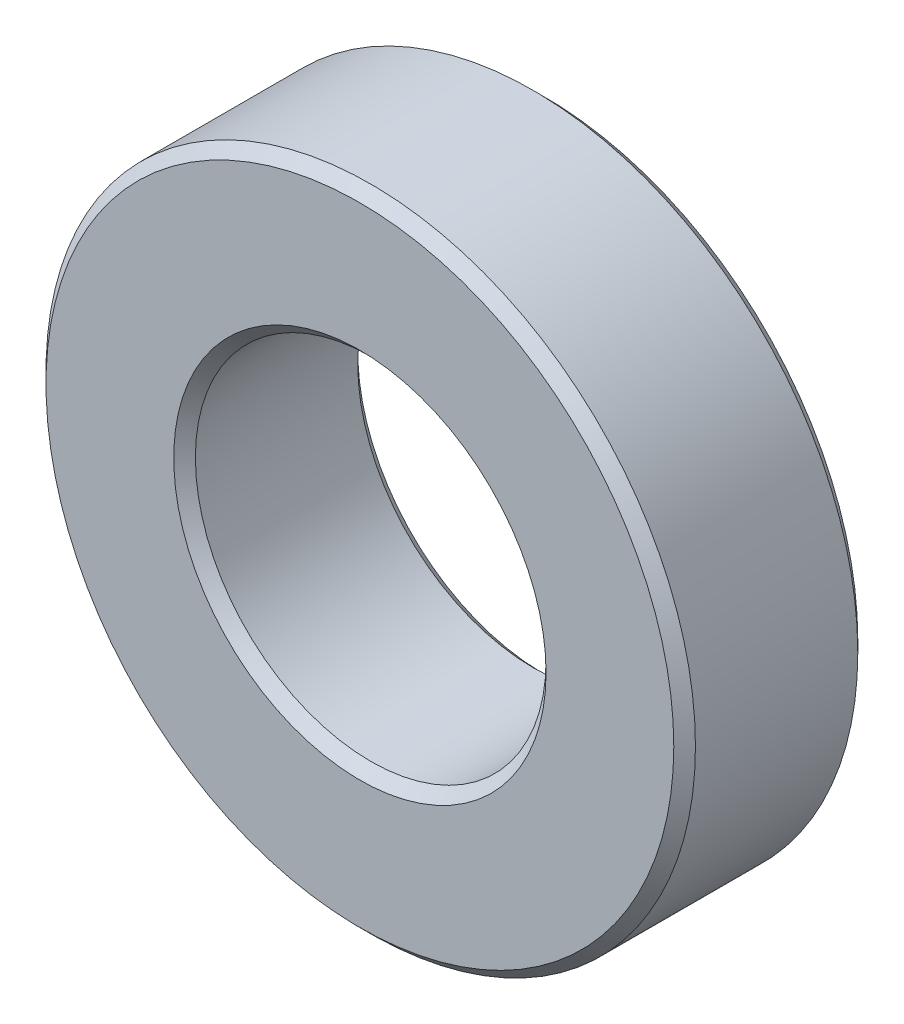
from build123d import *

# Parameters (mm, degrees)
ESQUISSE1_R        = 15
ESQUISSE1_R_2      = 8.1
BOSS_EXTRU_1_DEPTH = 8.5
CHANFREIN1_SIZE    = 0.5


with BuildPart() as part:
    # Esquisse1 → Boss.-Extru.1 (new body)
    with BuildSketch(Plane.XY):
        Circle(ESQUISSE1_R)
        Circle(ESQUISSE1_R_2, mode=Mode.SUBTRACT)
    extrude(amount=BOSS_EXTRU_1_DEPTH)

    # Chanfrein1
    chanfrein1_edges = [part.edges().sort_by_distance(p)[0] for p in [
        (-15, 0, 0),
        (-15, 0, 8.5),
        (-8.1, 0, 0),
        (-8.1, 0, 8.5),
    ]]
    chamfer(chanfrein1_edges, length=CHANFREIN1_SIZE)


solid = part.part
